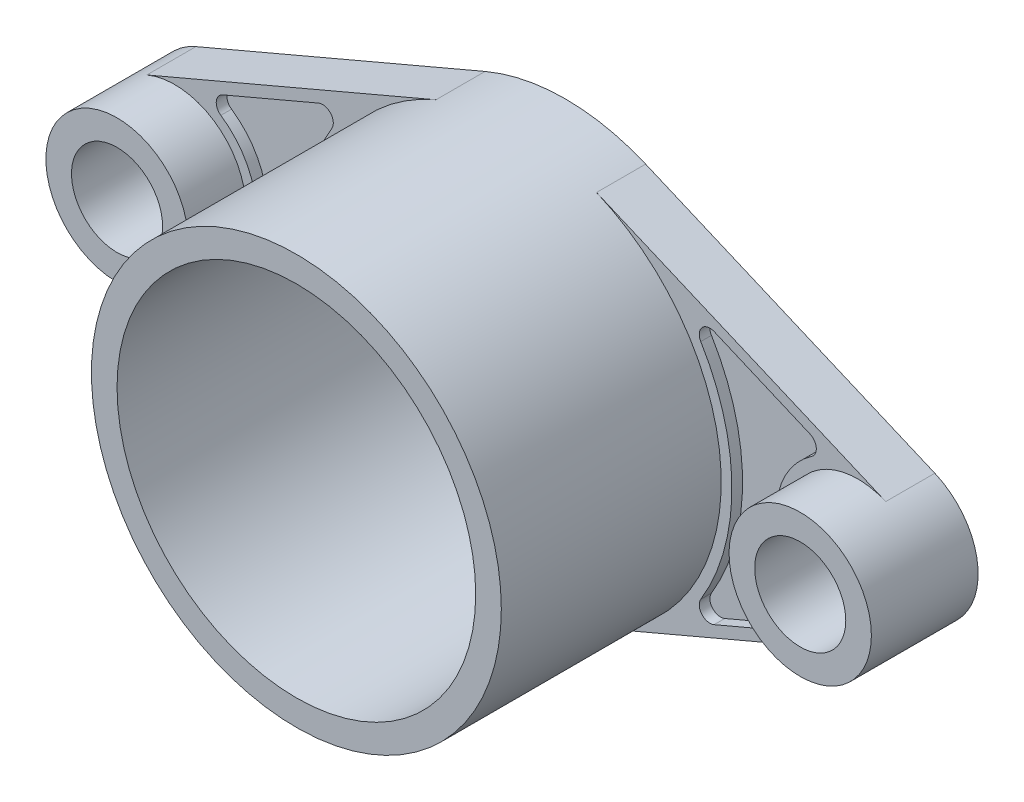
from build123d import *

# Parameters (mm, degrees)
BOSS_EXTRUDE1_DEPTH   = 11.5
BOSS_EXTRUDE1_2_DEPTH = 11.5
CUT_EXTRUDE1_DEPTH    = 2.5
SKETCH1_4_R           = 16.666666667
SKETCH1_4_R_2         = 10.666666667
BOSS_EXTRUDE2_DEPTH   = 25
SKETCH1_5_R           = 42
BOSS_EXTRUDE3_DEPTH   = 63


with BuildPart() as part:
    # Sketch1 → Boss-Extrude1 (new body)
    with BuildSketch(Plane.XY):
        with BuildLine():
            ThreePointArc((18.8, 44.165144628), (48, 0), (18.8, -44.165144628))
            Line((18.8, -44.165144628), (86.527777778, -15.335119662))
            ThreePointArc((86.527777778, -15.335119662), (63.333333333, 0), (86.527777778, 15.335119662))
            Line((86.527777778, 15.335119662), (18.8, 44.165144628))
        make_face()
    extrude(amount=BOSS_EXTRUDE1_DEPTH)


with BuildPart() as body_2:
    # Sketch1 → Boss-Extrude1 2 (new body)
    with BuildSketch(Plane.XY):
        with BuildLine():
            Line((-86.527777778, -15.335119662), (-18.8, -44.165144628))
            ThreePointArc((-18.8, -44.165144628), (-48, 0), (-18.8, 44.165144628))
            Line((-18.8, 44.165144628), (-86.527777778, 15.335119662))
            ThreePointArc((-86.527777778, 15.335119662), (-63.333333333, 0), (-86.527777778, -15.335119662))
        make_face()
    extrude(amount=BOSS_EXTRUDE1_2_DEPTH)

    # Sketch2 → Cut-Extrude1 (cut)
    with BuildSketch(Plane.XY.offset(11.5)):
        with BuildLine():
            Line((-46.329311604, 29.72952886), (-68.749829189, 20.185673992))
            ThreePointArc((-68.749829189, 20.185673992), (-70.258507425, 18.131633045), (-69.181739923, 15.821705345))
            ThreePointArc((-69.181739923, 15.821705345), (-60.833333333, 0), (-69.181739923, -15.821705345))
            ThreePointArc((-69.181739923, -15.821705345), (-70.258507425, -18.131633045), (-68.749829189, -20.185673992))
            Line((-68.749829189, -20.185673992), (-46.329311604, -29.72952886))
            ThreePointArc((-46.329311604, -29.72952886), (-43.461816215, -29.067618209), (-43.210987158, -26.135427849))
            ThreePointArc((-43.210987158, -26.135427849), (-50.5, 0), (-43.210987158, 26.135427849))
            ThreePointArc((-43.210987158, 26.135427849), (-43.461816215, 29.067618209), (-46.329311604, 29.72952886))
        make_face()
    cut_extrude1 = extrude(amount=-CUT_EXTRUDE1_DEPTH, mode=Mode.SUBTRACT)


with BuildPart() as part_1:
    add(part.part)

    # Mirror1: Cut-Extrude1 across plane
    add(cut_extrude1.mirror(Plane(origin=(0, 0, 0), x_dir=(0, 0, 1), z_dir=(1, 0, 0))), mode=Mode.SUBTRACT)

    add(body_2.part)  # Boss-Extrude2 merges body 2
    # Sketch1<4> → Boss-Extrude2 (add)
    # profile 1 of 2: a face of its own
    with BuildSketch(Plane.XY):
        with Locations((80, 0)):
            Circle(SKETCH1_4_R)
        with Locations((80, 0)):
            Circle(SKETCH1_4_R_2, mode=Mode.SUBTRACT)
    # profile 2 of 2: a face of its own
    with BuildSketch(Plane.XY):
        with Locations((-80, 0)):
            Circle(SKETCH1_4_R)
        with Locations((-80, 0)):
            Circle(SKETCH1_4_R_2, mode=Mode.SUBTRACT)
    extrude(amount=BOSS_EXTRUDE2_DEPTH)

    # Sketch1<5> → Boss-Extrude3 (add)
    with BuildSketch(Plane.XY):
        with BuildLine():
            ThreePointArc((-18.8, -44.165144628), (0, -48), (18.8, -44.165144628))
            ThreePointArc((18.8, -44.165144628), (40.03998002, -26.472627372), (48, 0))
            ThreePointArc((48, 0), (40.03998002, 26.472627372), (18.8, 44.165144628))
            ThreePointArc((18.8, 44.165144628), (0, 48), (-18.8, 44.165144628))
            ThreePointArc((-18.8, 44.165144628), (-48, 0), (-18.8, -44.165144628))
        make_face()
        Circle(SKETCH1_5_R, mode=Mode.SUBTRACT)
    extrude(amount=BOSS_EXTRUDE3_DEPTH)


solid = part_1.part
